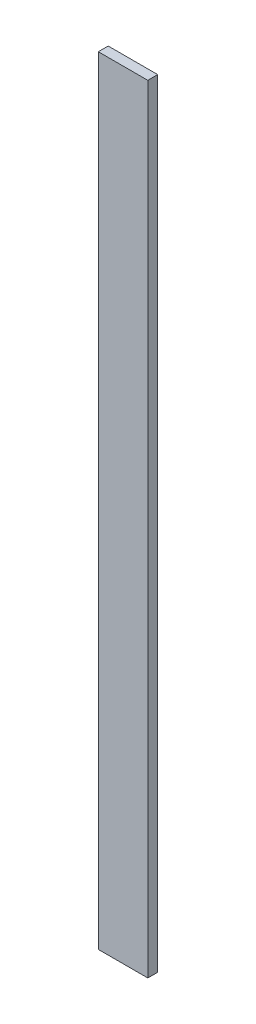
from build123d import *

# Parameters (mm, degrees)
SKETCH_2_W      = 9.999999998
SKETCH_2_H      = 156.999999961
EXTRUDE_1_DEPTH = 2


with BuildPart() as part:
    # 草图2 → 凸台-拉伸1 (new body)
    with BuildSketch(Plane.XY):
        with Locations((191.488368911, -122.386602216)):
            Rectangle(SKETCH_2_W, SKETCH_2_H)
    extrude(amount=EXTRUDE_1_DEPTH)


solid = part.part
